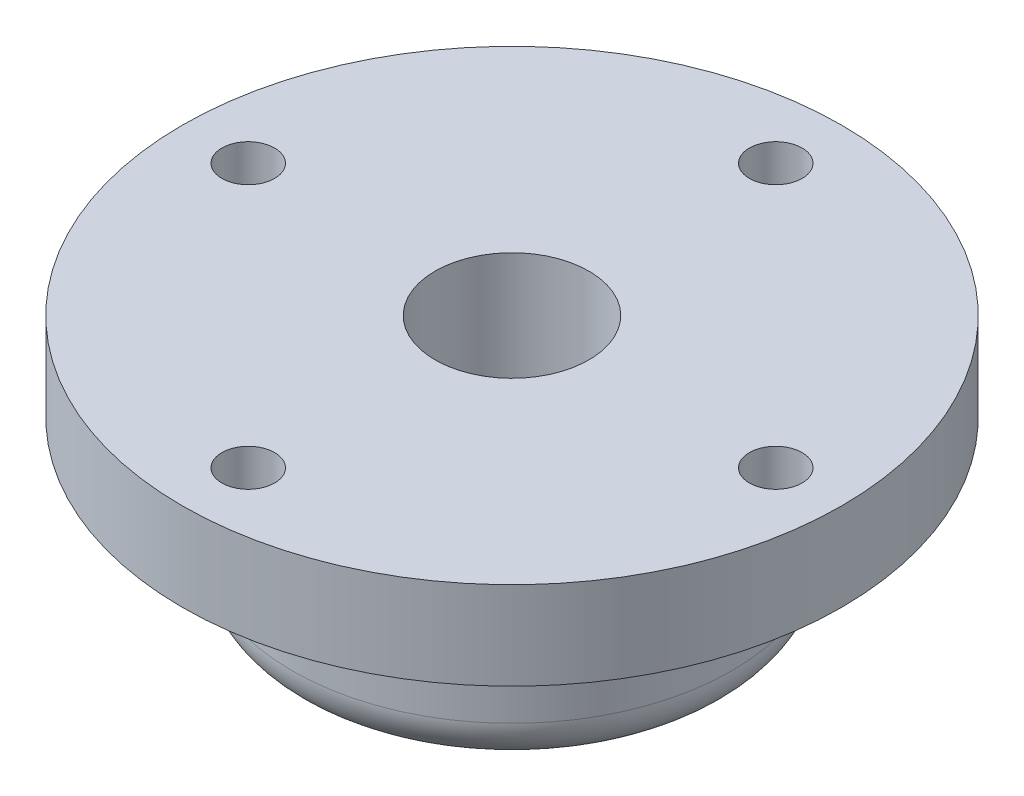
from build123d import *

# Parameters (mm, degrees)
CORTAR_EXTRUIR1_DEPTH      = 112.691539518
CORTAR_EXTRUIR1_DEPTH_BACK = 29
CROQUIS4_R                 = 6
REDONDEO3_R                = 10


with BuildPart() as part:
    # Croquis1 → Revolución1 (revolve)
    with BuildSketch(Plane.XY, mode=Mode.PRIVATE) as revoluci_n1_sk:
        Polygon((75, 42.359797144), (50, 42.359797144), (50, 7.359797144), (17.5, 7.359797144), (17.5, 42.359797144), (17.5, 62.359797144), (75, 62.359797144), align=None)
    revolve(revoluci_n1_sk.sketch.rotate(Axis((0, 71.893155669, 0), (0, -1, 0)), 180), axis=Axis((0, 71.893155669, 0), (0, -1, 0)))

    # Croquis4 → Cortar-Extruir1 (cut, two sides: drawn at the far end of the back side and taken through both)
    with BuildSketch(Plane.XZ.offset(-42.359797144).offset(-CORTAR_EXTRUIR1_DEPTH_BACK)):
        with Locations(Location((0, 60, 0), (0, 0, 180))):
            Circle(CROQUIS4_R)
        with Locations(Location((60, 0, 0), (0, 0, 180))):
            Circle(CROQUIS4_R)
        with Locations(Location((0, -60, 0), (0, 0, 180))):
            Circle(CROQUIS4_R)
        with Locations(Location((-60, 0, 0), (0, 0, 180))):
            Circle(CROQUIS4_R)
    extrude(amount=CORTAR_EXTRUIR1_DEPTH + CORTAR_EXTRUIR1_DEPTH_BACK, mode=Mode.SUBTRACT)

    # Redondeo3
    redondeo3_edges = [part.edges().sort_by_distance(p)[0] for p in [
        (17.5, 7.359797144, 0),
        (50, 7.359797144, 0),
    ]]
    fillet(redondeo3_edges, radius=REDONDEO3_R)


solid = part.part
